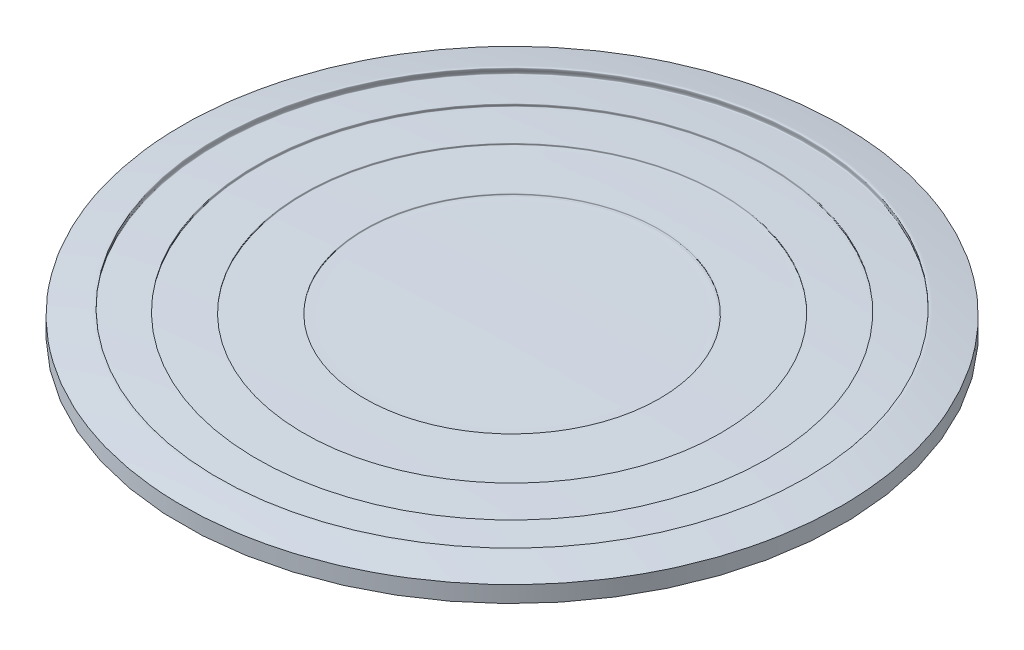
from build123d import *


with BuildPart() as part:
    # 草图2 → 旋转1 (revolve)
    with BuildSketch(Plane.XY):
        with BuildLine():
            Line((0, 0), (20, 0))
            Line((20, 0), (20, 1))
            add(Edge.make_bspline(
                [(0, 1.0810604), (0.150585214, 1.081052366), (0.481872682, 1.080915633), (1.144446995, 1.079932269), (1.987720776, 1.077394585), (3.523671243, 1.069652426), (5.481211968, 1.052638998), (7.167613812, 1.029629927), (8.040894952, 1.015559238), (8.191461923, 1.013075913), (8.311907295, 1.01106393), (8.402261922, 1.00951696), (8.492538393, 1.008033229), (8.583105266, 1.006236125), (8.672586901, 1.005529073), (8.766117337, 1.000676781), (8.844536125, 1.011215806), (8.984824507, 0.962328419), (8.910027125, 1.115066789), (8.983713542, 1.098448265), (9.018586247, 1.100204981), (9.056697612, 1.098648614), (9.093941085, 1.09797537), (9.131416993, 1.097061102), (9.168830525, 1.09620682), (9.268644256, 1.093874011), (9.455763477, 1.089468953), (9.742703114, 1.082494107), (10.05457365, 1.074677636), (10.902860466, 1.05270971), (11.663760483, 1.030890954), (12.337294618, 1.009873011), (12.387184347, 1.008310548), (12.424606037, 1.007130599), (12.462011835, 1.005963783), (12.499476963, 1.004731724), (12.536719983, 1.00372573), (12.574789443, 1.001859815), (12.609774511, 1.003185808), (12.696762863, 0.983349766), (12.602456242, 1.148402597), (12.679000896, 1.132799174), (12.706240635, 1.133108334), (12.735359285, 1.131460122), (12.763974249, 1.13033308), (12.792724086, 1.129062827), (12.840579551, 1.127003472), (12.926754116, 1.123243655), (13.099065172, 1.115695284), (13.30010845, 1.10671905), (13.884043562, 1.080227052), (14.515782062, 1.049978026), (15.099570507, 1.020333425), (15.271829957, 1.011450343), (15.310112639, 1.009467749), (15.348384194, 1.007490892), (15.377115033, 1.005976582), (15.405743786, 1.004567374), (15.43475225, 1.002752098), (15.462343322, 1.002439823), (15.56179393, 0.984488624), (15.422650439, 1.218544454), (15.516790383, 1.200775637), (15.540203543, 1.199730397), (15.564639487, 1.197584174), (15.588800873, 1.195729241), (15.613035728, 1.193792404), (15.661465811, 1.189955473), (15.758349988, 1.182221435), (15.935933505, 1.167955622), (16.153874602, 1.150183142), (16.734971197, 1.102109868), (17.251350148, 1.057415298), (17.703038059, 1.016794766), (17.74336761, 1.013156328), (17.767562024, 1.010973665), (17.791766782, 1.008775748), (17.815931634, 1.006620071), (17.840245144, 1.004293341), (17.864002655, 1.002591226), (18.027587667, 0.976953022), (17.751410552, 1.446977868), (17.910192587, 1.408709205), (17.931213026, 1.405171977), (17.952677251, 1.401111692), (17.97402149, 1.397186168), (18.009647082, 1.390572544), (18.08085793, 1.377355922), (18.19480281, 1.356060482), (18.365654147, 1.323901514), (18.543566126, 1.29003138), (18.785430482, 1.243505718), (18.99873681, 1.20190735), (19.254575211, 1.151336402), (19.474786009, 1.107313004), (19.723278545, 1.056950359), (19.886491839, 1.023453565), (19.978718196, 1.004402396), (19.992906069, 1.001467465), (20, 1)],
                knots=[0, 0, 0, 0, 0.021608144, 0.047537915, 0.09507583, 0.142613748, 0.267940978, 0.375981699, 0.384624957, 0.393268213, 0.397589839, 0.401911469, 0.406233098, 0.410554727, 0.414876355, 0.419197982, 0.423519614, 0.427841241, 0.432689254, 0.434479909, 0.436270563, 0.438061222, 0.439851874, 0.441642531, 0.443433187, 0.445223841, 0.455967778, 0.470293021, 0.486408942, 0.500734152, 0.59205761, 0.595638917, 0.597429555, 0.599220198, 0.601010893, 0.602801547, 0.604592206, 0.606382822, 0.608173492, 0.609964167, 0.616433079, 0.617808105, 0.619183185, 0.620558223, 0.621933314, 0.623308363, 0.624683418, 0.62880857, 0.635683875, 0.649434451, 0.657684826, 0.719562432, 0.740188281, 0.741563347, 0.744313453, 0.74568854, 0.747063586, 0.748438639, 0.749813699, 0.751188766, 0.752563792, 0.7622911, 0.763453215, 0.764615295, 0.765777386, 0.766939441, 0.768101506, 0.769263631, 0.773911957, 0.782046512, 0.7948294, 0.805288175, 0.865716435, 0.869202682, 0.870364758, 0.871526847, 0.872688901, 0.873850968, 0.875013095, 0.87617514, 0.877337245, 0.8970903, 0.89812979, 0.899169275, 0.900208754, 0.901248272, 0.902287739, 0.905406243, 0.911643189, 0.918919639, 0.930354042, 0.93763048, 0.954262366, 0.961538778, 0.975052173, 0.986486625, 0.997921016, 0.998960509, 1, 1, 1, 1], degree=3))
            Line((0, 1.0810604), (0, 0))
        make_face()
    revolve(axis=Axis((0, 0, 0), (0, 1, 0)))


solid = part.part
